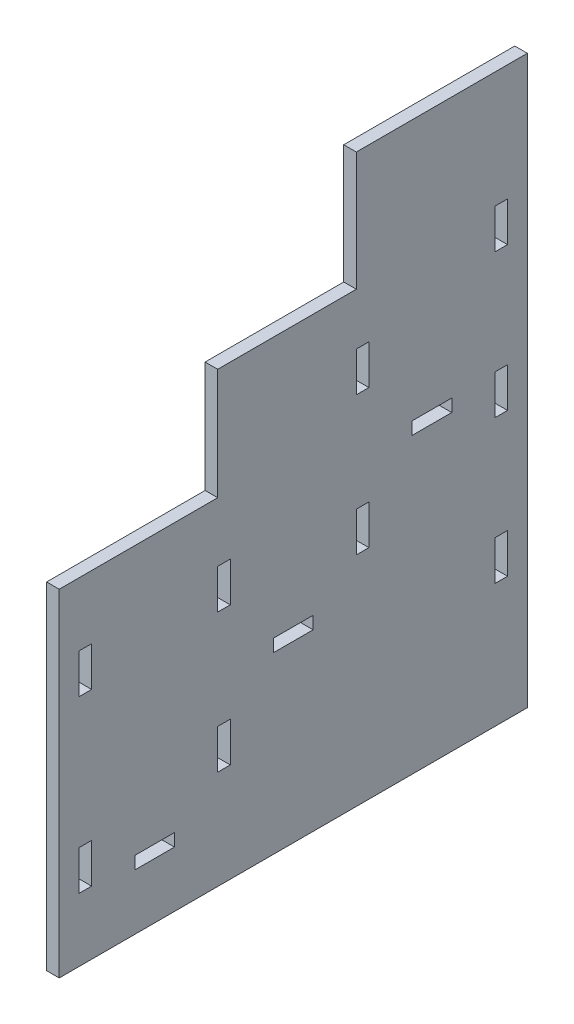
from build123d import *

# Parameters (mm, degrees)
SALIENTE_EXTRUIR1_DEPTH = 6.35
CROQUIS2_W              = 6.35
CROQUIS2_H              = 20
CORTAR_EXTRUIR1_DEPTH   = 10
CROQUIS3_W              = 6.35
CROQUIS3_H              = 286.16
SALIENTE_EXTRUIR2_DEPTH = 6.35
CROQUIS4_W              = 6.35
CROQUIS4_H              = 20
CORTAR_EXTRUIR2_DEPTH   = 6.35
CROQUIS5_W              = 20
CROQUIS5_H              = 6.35
CORTAR_EXTRUIR3_DEPTH   = 10
CROQUIS6_W              = 10
CROQUIS6_H              = 286.16
CROQUIS6_H_2            = 170
SALIENTE_EXTRUIR3_DEPTH = 6.35


with BuildPart() as part:
    # Croquis1 → Saliente-Extruir1 (new body)
    with BuildSketch(Plane(origin=(0, 0, 0), x_dir=(0, 0, -1), z_dir=(1, 0, 0))):
        Polygon((-117.242954184, -155.20246182), (-117.242954184, 14.79753818), (-47.242954184, 14.79753818), (-47.242954184, 70.95753818), (22.757045816, 70.95753818), (22.757045816, 130.95753818), (92.757045816, 130.95753818), (92.757045816, -155.20246182), align=None)
    extrude(amount=SALIENTE_EXTRUIR1_DEPTH)

    # Croquis2 → Cortar-Extruir1 (cut)
    with BuildSketch(Plane.ZY):
        with Locations((114.067954184, -27.20246182)):
            Rectangle(CROQUIS2_W, CROQUIS2_H)
        with Locations((114.067954184, -113.20246182)):
            Rectangle(CROQUIS2_W, CROQUIS2_H)
        with Locations((44.067954184, -25.20246182)):
            Rectangle(CROQUIS2_W, CROQUIS2_H)
        with Locations((44.067954184, -95.20246182)):
            Rectangle(CROQUIS2_W, CROQUIS2_H)
        with Locations((-25.932045816, 34.79753818)):
            Rectangle(CROQUIS2_W, CROQUIS2_H)
        with Locations((-25.932045816, -35.20246182)):
            Rectangle(CROQUIS2_W, CROQUIS2_H)
    extrude(amount=-CORTAR_EXTRUIR1_DEPTH, mode=Mode.SUBTRACT)

    # Croquis3 → Saliente-Extruir2 (add)
    with BuildSketch(Plane(origin=(0, 0, 0), x_dir=(0, 0, -1), z_dir=(1, 0, 0))):
        with Locations((95.932045816, -12.12246182)):
            Rectangle(CROQUIS3_W, CROQUIS3_H)
    extrude(amount=SALIENTE_EXTRUIR2_DEPTH)

    # Croquis4 → Cortar-Extruir2 (cut)
    with BuildSketch(Plane.ZY):
        with Locations((-95.932045816, -10.20246182)):
            Rectangle(CROQUIS4_W, CROQUIS4_H)
        with Locations((-95.932045816, 62.29753818)):
            Rectangle(CROQUIS4_W, CROQUIS4_H)
        with Locations((-95.932045816, -82.70246182)):
            Rectangle(CROQUIS4_W, CROQUIS4_H)
    extrude(amount=-CORTAR_EXTRUIR2_DEPTH, mode=Mode.SUBTRACT)

    # Croquis5 → Cortar-Extruir3 (cut)
    with BuildSketch(Plane(origin=(6.35, 0, 0), x_dir=(0, 0, -1), z_dir=(1, 0, 0))):
        with Locations((-79.062954184, -123.86746182)):
            Rectangle(CROQUIS5_W, CROQUIS5_H)
        with Locations((-9.062954184, -63.86746182)):
            Rectangle(CROQUIS5_W, CROQUIS5_H)
        with Locations((60.937045816, -3.86746182)):
            Rectangle(CROQUIS5_W, CROQUIS5_H)
    extrude(amount=-CORTAR_EXTRUIR3_DEPTH, mode=Mode.SUBTRACT)

    # Croquis6 → Saliente-Extruir3 (add)
    with BuildSketch(Plane(origin=(0, 0, 0), x_dir=(0, 0, -1), z_dir=(1, 0, 0))):
        with Locations((104.107045816, -12.12246182)):
            Rectangle(CROQUIS6_W, CROQUIS6_H)
        with Locations((-122.242954184, -70.20246182)):
            Rectangle(CROQUIS6_W, CROQUIS6_H_2)
    extrude(amount=SALIENTE_EXTRUIR3_DEPTH)


solid = part.part
